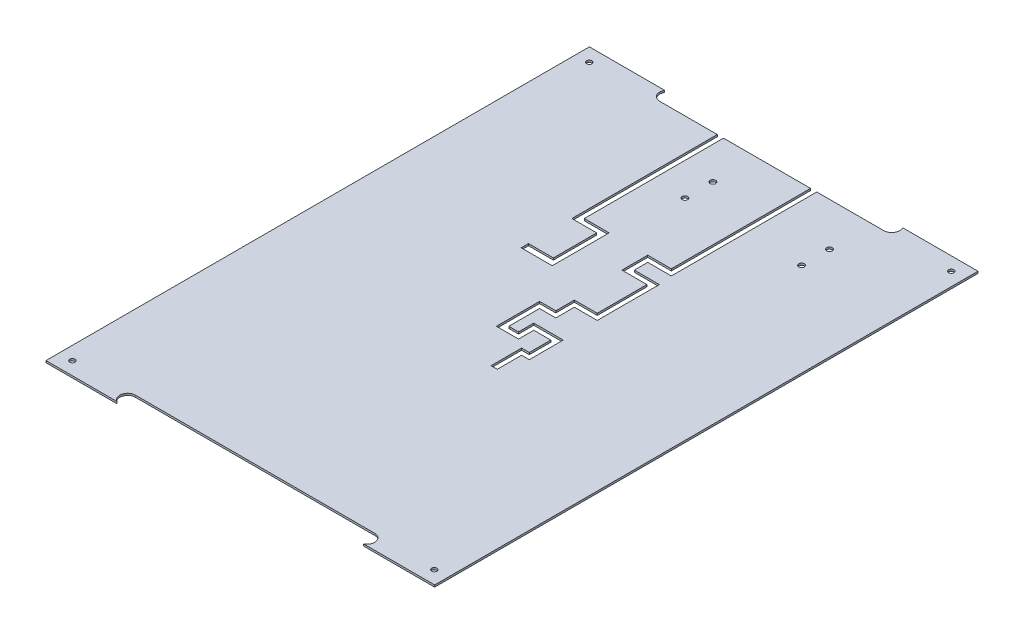
from build123d import *

# Parameters (mm, degrees)
SKETCH1_R                     = 2.15265
SKETCH1_R_2                   = 9.525
SKETCH1_R_3                   = 2.4892
BOSS_EXTRUDE1_DEPTH           = 1.5875
CUT_EXTRUDE1_DEPTH            = 2.54
F_13_64_0_18_DIAMETER_HOLE1_D = 4.572
SKETCH7_W                     = 317.5
SKETCH7_H                     = 35.56
CUT_EXTRUDE2_DEPTH            = 288.517243505


with BuildPart() as part:
    # Sketch1 → Boss-Extrude1 (new body)
    # profile 1 of 21: a face of its own
    with BuildSketch(Plane(origin=(0, 0, 0), x_dir=(1, 0, 0), z_dir=(0, 1, 0))):
        with BuildLine():
            Line((-97.234377561, 239.7125), (-158.75, 239.7125))
            Line((-158.75, 239.7125), (-158.75, -239.7125))
            Line((-158.75, -239.7125), (158.75, -239.7125))
            Line((158.75, -239.7125), (158.75, 239.7125))
            Line((158.75, 239.7125), (97.234377561, 239.7125))
            ThreePointArc((97.234377561, 239.7125), (97.124777, 233.170194434), (91.44, 229.930273932))
            Line((91.44, 229.930273932), (-91.44, 229.930273932))
            ThreePointArc((-91.44, 229.930273932), (-97.124777, 233.170194434), (-97.234377561, 239.7125))
        make_face()
        with Locations(Location((-147.828, -193.4845, 0), (0, 0, 270))):
            Circle(SKETCH1_R, mode=Mode.SUBTRACT)
        with Locations((-104.14, -4.1275)):
            Circle(SKETCH1_R_2, mode=Mode.SUBTRACT)
        with BuildLine():
            ThreePointArc((-97.79, -204.7875), (-104.14, -198.4375), (-97.79, -192.0875))
            Line((-97.79, -192.0875), (97.79, -192.0875))
            ThreePointArc((97.79, -192.0875), (104.14, -198.4375), (97.79, -204.7875))
            Line((97.79, -204.7875), (-97.79, -204.7875))
        make_face(mode=Mode.SUBTRACT)
        with Locations(Location((147.828, -193.4845, 0), (0, 0, 270))):
            Circle(SKETCH1_R, mode=Mode.SUBTRACT)
        with Locations((104.14, -4.1275)):
            Circle(SKETCH1_R_2, mode=Mode.SUBTRACT)
        with Locations((-126.365, 30.1625)):
            Circle(SKETCH1_R, mode=Mode.SUBTRACT)
        with Locations((-126.365, 49.2125)):
            Circle(SKETCH1_R, mode=Mode.SUBTRACT)
        with Locations((-104.14, 40.0685)):
            Circle(SKETCH1_R_2, mode=Mode.SUBTRACT)
        with Locations((-104.14, 84.2645)):
            Circle(SKETCH1_R_3, mode=Mode.SUBTRACT)
        with Locations((-126.365, 163.5125)):
            Circle(SKETCH1_R, mode=Mode.SUBTRACT)
        with Locations((-126.365, 182.5625)):
            Circle(SKETCH1_R, mode=Mode.SUBTRACT)
        with Locations((-104.14, 128.4605)):
            Circle(SKETCH1_R_2, mode=Mode.SUBTRACT)
        with Locations((-104.14, 172.6565)):
            Circle(SKETCH1_R_2, mode=Mode.SUBTRACT)
        with Locations(Location((-147.828, 228.7905, 0), (0, 0, 270))):
            Circle(SKETCH1_R, mode=Mode.SUBTRACT)
        with Locations((-104.14, 216.8525)):
            Circle(SKETCH1_R_2, mode=Mode.SUBTRACT)
        with Locations((104.14, 40.0685)):
            Circle(SKETCH1_R_2, mode=Mode.SUBTRACT)
        with Locations((126.365, 30.1625)):
            Circle(SKETCH1_R, mode=Mode.SUBTRACT)
        with Locations((126.365, 49.2125)):
            Circle(SKETCH1_R, mode=Mode.SUBTRACT)
        with Locations((104.14, 84.2645)):
            Circle(SKETCH1_R_3, mode=Mode.SUBTRACT)
        with Locations((104.14, 128.4605)):
            Circle(SKETCH1_R_2, mode=Mode.SUBTRACT)
        with Locations((104.14, 172.6565)):
            Circle(SKETCH1_R_2, mode=Mode.SUBTRACT)
        with Locations((126.365, 163.5125)):
            Circle(SKETCH1_R, mode=Mode.SUBTRACT)
        with Locations((126.365, 182.5625)):
            Circle(SKETCH1_R, mode=Mode.SUBTRACT)
        with Locations((104.14, 216.8525)):
            Circle(SKETCH1_R_2, mode=Mode.SUBTRACT)
        with Locations(Location((147.828, 228.7905, 0), (0, 0, 270))):
            Circle(SKETCH1_R, mode=Mode.SUBTRACT)
    # profile 2 of 21: a face of its own
    with BuildSketch(Plane(origin=(0, 0, 0), x_dir=(1, 0, 0), z_dir=(0, 1, 0))):
        with Locations((-104.14, 216.8525)):
            Circle(SKETCH1_R_2)
    # profile 3 of 21: a face of its own
    with BuildSketch(Plane(origin=(0, 0, 0), x_dir=(1, 0, 0), z_dir=(0, 1, 0))):
        with Locations((-104.14, 172.6565)):
            Circle(SKETCH1_R_2)
    # profile 4 of 21: a face of its own
    with BuildSketch(Plane(origin=(0, 0, 0), x_dir=(1, 0, 0), z_dir=(0, 1, 0))):
        with Locations((-104.14, 128.4605)):
            Circle(SKETCH1_R_2)
    # profile 5 of 21: a face of its own
    with BuildSketch(Plane(origin=(0, 0, 0), x_dir=(1, 0, 0), z_dir=(0, 1, 0))):
        with Locations((-104.14, -4.1275)):
            Circle(SKETCH1_R_2)
    # profile 6 of 21: a face of its own
    with BuildSketch(Plane(origin=(0, 0, 0), x_dir=(1, 0, 0), z_dir=(0, 1, 0))):
        with Locations((-104.14, 40.0685)):
            Circle(SKETCH1_R_2)
    # profile 7 of 21: a face of its own
    with BuildSketch(Plane(origin=(0, 0, 0), x_dir=(1, 0, 0), z_dir=(0, 1, 0))):
        with Locations((104.14, 40.0685)):
            Circle(SKETCH1_R_2)
    # profile 8 of 21: a face of its own
    with BuildSketch(Plane(origin=(0, 0, 0), x_dir=(1, 0, 0), z_dir=(0, 1, 0))):
        with Locations((104.14, -4.1275)):
            Circle(SKETCH1_R_2)
    # profile 9 of 21: a face of its own
    with BuildSketch(Plane(origin=(0, 0, 0), x_dir=(1, 0, 0), z_dir=(0, 1, 0))):
        with Locations((104.14, 172.6565)):
            Circle(SKETCH1_R_2)
    # profile 10 of 21: a face of its own
    with BuildSketch(Plane(origin=(0, 0, 0), x_dir=(1, 0, 0), z_dir=(0, 1, 0))):
        with Locations((104.14, 216.8525)):
            Circle(SKETCH1_R_2)
    # profile 11 of 21: a face of its own
    with BuildSketch(Plane(origin=(0, 0, 0), x_dir=(1, 0, 0), z_dir=(0, 1, 0))):
        with Locations((104.14, 128.4605)):
            Circle(SKETCH1_R_2)
    # profile 12 of 21: a face of its own
    with BuildSketch(Plane(origin=(0, 0, 0), x_dir=(1, 0, 0), z_dir=(0, 1, 0))):
        with Locations((126.365, 30.1625)):
            Circle(SKETCH1_R)
    # profile 13 of 21: a face of its own
    with BuildSketch(Plane(origin=(0, 0, 0), x_dir=(1, 0, 0), z_dir=(0, 1, 0))):
        with Locations((126.365, 49.2125)):
            Circle(SKETCH1_R)
    # profile 14 of 21: a face of its own
    with BuildSketch(Plane(origin=(0, 0, 0), x_dir=(1, 0, 0), z_dir=(0, 1, 0))):
        with Locations((126.365, 163.5125)):
            Circle(SKETCH1_R)
    # profile 15 of 21: a face of its own
    with BuildSketch(Plane(origin=(0, 0, 0), x_dir=(1, 0, 0), z_dir=(0, 1, 0))):
        with Locations((126.365, 182.5625)):
            Circle(SKETCH1_R)
    # profile 16 of 21: a face of its own
    with BuildSketch(Plane(origin=(0, 0, 0), x_dir=(1, 0, 0), z_dir=(0, 1, 0))):
        with Locations((-126.365, 163.5125)):
            Circle(SKETCH1_R)
    # profile 17 of 21: a face of its own
    with BuildSketch(Plane(origin=(0, 0, 0), x_dir=(1, 0, 0), z_dir=(0, 1, 0))):
        with Locations((-126.365, 182.5625)):
            Circle(SKETCH1_R)
    # profile 18 of 21: a face of its own
    with BuildSketch(Plane(origin=(0, 0, 0), x_dir=(1, 0, 0), z_dir=(0, 1, 0))):
        with Locations((-126.365, 49.2125)):
            Circle(SKETCH1_R)
    # profile 19 of 21: a face of its own
    with BuildSketch(Plane(origin=(0, 0, 0), x_dir=(1, 0, 0), z_dir=(0, 1, 0))):
        with Locations((-126.365, 30.1625)):
            Circle(SKETCH1_R)
    # profile 20 of 21: a face of its own
    with BuildSketch(Plane(origin=(0, 0, 0), x_dir=(1, 0, 0), z_dir=(0, 1, 0))):
        with Locations((104.14, 84.2645)):
            Circle(SKETCH1_R_3)
    # profile 21 of 21: a face of its own
    with BuildSketch(Plane(origin=(0, 0, 0), x_dir=(1, 0, 0), z_dir=(0, 1, 0))):
        with Locations((-104.14, 84.2645)):
            Circle(SKETCH1_R_3)
    extrude(amount=BOSS_EXTRUDE1_DEPTH)

    # Sketch2 → Cut-Extrude1 (cut)
    with BuildSketch(Plane(origin=(0, 1.5875, 0), x_dir=(1, 0, 0), z_dir=(0, 1, 0))):
        Polygon((-39.37, 230.1875), (-44.45, 230.1875), (-44.45, 116.18638997), (-44.45, 111.10638997), (-39.37, 111.10638997), (-24.13, 111.10638997), (-24.13, 80.773994761), (-24.13, 75.693994761), (-44.45, 75.693994761), (-44.45, 69.693451711), (-19.05, 69.693451711), (-19.05, 75.693994761), (-19.05, 111.10638997), (-19.05, 116.18638997), (-39.37, 116.18638997), align=None)
        Polygon((36.83, 230.1875), (31.75, 230.1875), (31.75, 116.18638997), (12.478280381, 116.18638997), (12.478280381, 111.10638997), (12.478280381, 97.725538056), (12.478280381, 95.043026282), (27.466923788, 95.043026282), (32.944773159, 95.043026282), (32.944773159, 94.327747899), (32.944773159, 54.465469302), (19.338923788, 54.465469302), (14.258923788, 54.465469302), (14.258923788, 49.385469302), (14.258923788, 39.311344325), (6.047836395, 39.311344325), (0.967836395, 39.311344325), (0.967836395, 34.231344325), (0.967836395, 9.126281939), (0.967836395, 4.046281939), (6.047836395, 4.046281939), (13.97, 4.046281939), (19.05, 4.046281939), (19.05, 9.126281939), (19.05, 16.514356244), (32.944773159, 16.514356244), (32.944773159, -1.068708856), (26.67, -1.068708856), (26.67, -6.148708856), (26.67, -26.035), (31.75, -26.035), (31.75, -6.148708856), (32.944773159, -6.148708856), (38.024773159, -6.148708856), (38.024773159, -1.068708856), (38.024773159, 16.514356244), (38.024773159, 21.594356244), (19.05, 21.594356244), (13.97, 21.594356244), (13.97, 16.514356244), (13.97, 9.126281939), (6.047836395, 9.126281939), (6.047836395, 34.231344325), (14.258923788, 34.231344325), (19.338923788, 34.231344325), (19.338923788, 39.311344325), (19.338923788, 49.385469302), (38.024773159, 49.385469302), (38.024773159, 54.465469302), (38.024773159, 94.327747899), (38.024773159, 95.043026282), (38.024773159, 100.123026282), (19.090989095, 100.123026282), (17.558280381, 100.123026282), (17.558280381, 111.10638997), (36.83, 111.10638997), (36.83, 116.18638997), align=None)
    extrude(amount=-CUT_EXTRUDE1_DEPTH, mode=Mode.SUBTRACT)

    # 13/64 (0.18) Diameter Hole1 (through all)
    with Locations(Plane(origin=(0, 0, 0), x_dir=(-1, 0, 0), z_dir=(0, -1, 0))):
        with Locations((-82.55, 194.6275), (12.7, 194.6275), (-82.55, 171.7675), (12.7, 171.7675)):
            Hole(F_13_64_0_18_DIAMETER_HOLE1_D / 2)

    # Sketch7 → Cut-Extrude2 (cut, through all)
    with BuildSketch(Plane(origin=(0, 1.5875, 0), x_dir=(1, 0, 0), z_dir=(0, 1, 0))):
        with Locations((0, -221.9325)):
            Rectangle(SKETCH7_W, SKETCH7_H)
    extrude(amount=-CUT_EXTRUDE2_DEPTH, mode=Mode.SUBTRACT)


solid = part.part
